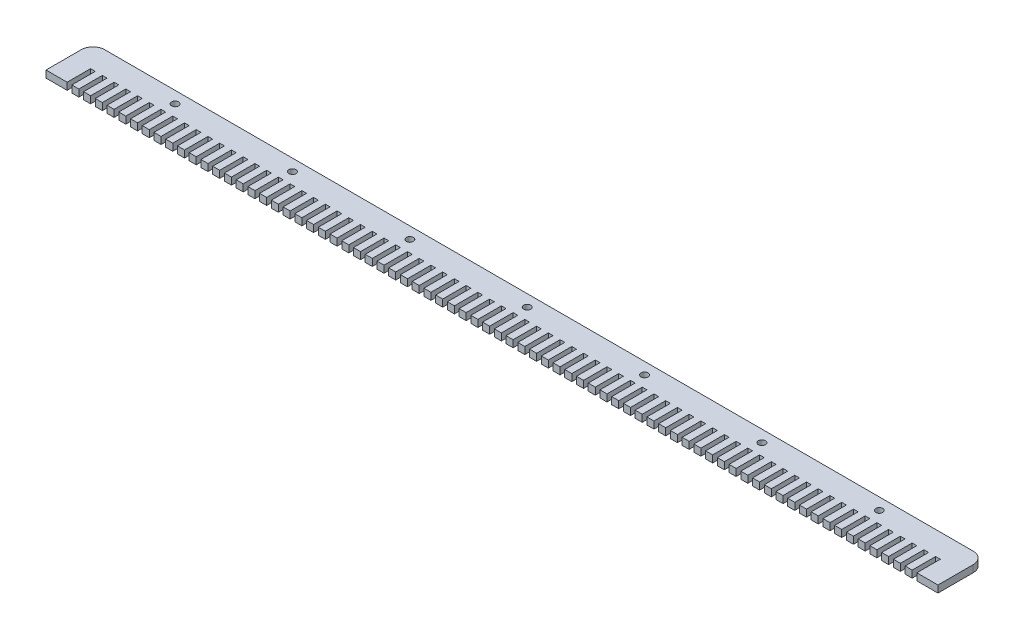
from build123d import *

# Parameters (mm, degrees)
SKETCH1_W           = 380
SKETCH1_H           = 20
EXTRUDE1_DEPTH      = 3
EXTRUDE2_REACH      = 192.287
SKETCH2_W           = 2
SKETCH2_H           = 10
LPATTERN2_COUNT     = 37
LPATTERN2_PITCH     = 5
LPATTERN2_COL_COUNT = 37
LPATTERN2_COL_PITCH = 5
CUT_EXTRUDE1_REACH  = 192.287
SKETCH3_R           = 1.5
LPATTERN3_COUNT     = 4
LPATTERN3_PITCH     = 50
LPATTERN3_COL_COUNT = 4
LPATTERN3_COL_PITCH = 50
FILLET1_R           = 5


with BuildPart() as part:
    # Sketch1 → Extrude1 (new body)
    with BuildSketch(Plane(origin=(0, 0, 0), x_dir=(1, 0, 0), z_dir=(0, 1, 0))):
        Rectangle(SKETCH1_W, SKETCH1_H)
    extrude(amount=EXTRUDE1_DEPTH)

    # Sketch2 → Extrude2 (cut, up to next)
    with BuildSketch(Plane(origin=(0, 3, 0), x_dir=(1, 0, 0), z_dir=(0, 1, 0)), mode=Mode.PRIVATE) as extrude2_sk1:
        with Locations((0, -5)):
            Rectangle(SKETCH2_W, SKETCH2_H)
    extrude2_tool1 = extrude(extrude2_sk1.sketch, amount=-EXTRUDE2_REACH, mode=Mode.PRIVATE) & part.part
    extrude2 = extrude2_tool1.solids().sort_by_distance((0, 3, 5))[0]
    add(extrude2, mode=Mode.SUBTRACT)

    # LPattern2: Extrude2 ×37
    with Locations(*[(i * LPATTERN2_PITCH, 0, 0) for i in range(1, LPATTERN2_COUNT)]):
        add(extrude2, mode=Mode.SUBTRACT)

    # LPattern2 col: Extrude2 ×37
    with Locations(*[(-i * LPATTERN2_COL_PITCH, 0, 0) for i in range(1, LPATTERN2_COL_COUNT)]):
        add(extrude2, mode=Mode.SUBTRACT)

    # Sketch3 → Cut-Extrude1 (cut, up to next)
    with BuildSketch(Plane(origin=(0, 3, 0), x_dir=(1, 0, 0), z_dir=(0, 1, 0)), mode=Mode.PRIVATE) as cut_extrude1_sk1:
        with Locations(Location((0, 5, 0), (0, 0, 270))):
            Circle(SKETCH3_R)
    cut_extrude1_tool1 = extrude(cut_extrude1_sk1.sketch, amount=-CUT_EXTRUDE1_REACH, mode=Mode.PRIVATE) & part.part
    cut_extrude1 = cut_extrude1_tool1.solids().sort_by_distance((0, 3, -5))[0]
    add(cut_extrude1, mode=Mode.SUBTRACT)

    # LPattern3: Cut-Extrude1 ×4
    with Locations(*[(-i * LPATTERN3_PITCH, 0, 0) for i in range(1, LPATTERN3_COUNT)]):
        add(cut_extrude1, mode=Mode.SUBTRACT)

    # LPattern3 col: Cut-Extrude1 ×4
    with Locations(*[(i * LPATTERN3_COL_PITCH, 0, 0) for i in range(1, LPATTERN3_COL_COUNT)]):
        add(cut_extrude1, mode=Mode.SUBTRACT)

    # Fillet1
    fillet1_edges = [part.edges().sort_by_distance(p)[0] for p in [
        (-190, 1.5, -10),
        (190, 1.5, -10),
    ]]
    fillet(fillet1_edges, radius=FILLET1_R)


solid = part.part
